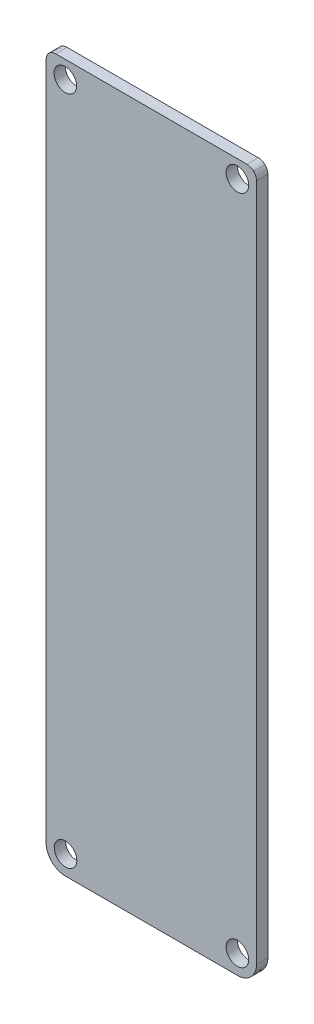
from build123d import *

# Parameters (mm, degrees)
BOSS_EXTRU_1_DEPTH      = 1.5
ESQUISSE2_R             = 1.304771715
ESQUISSE2_R_2           = 1.27
ENL_V_MAT_EXTRU_1_DEPTH = 10
ESQUISSE3_R             = 1.3
ENL_V_MAT_EXTRU_2_DEPTH = 10
ESQUISSE4_R             = 1.3
ENL_V_MAT_EXTRU_3_DEPTH = 10
ESQUISSE6_R             = 1.5
ENL_V_MAT_EXTRU_4_DEPTH = 10


with BuildPart() as part:
    # Model → Boss.-Extru.1 (new body)
    with BuildSketch(Plane.XY):
        with BuildLine():
            Line((110.49, -33.623931), (110.49, -38.623931))
            Line((110.49, -38.623931), (110.49, -39.893931))
            Line((110.49, -39.893931), (110.49, -123.713931))
            add(Edge.make_bspline(
                [(109.746051, -125.509982), (110.222394, -125.03364), (110.49, -124.387581), (110.49, -123.713931)],
                knots=[0, 0, 0, 0, 1, 1, 1, 1], degree=3))
            add(Edge.make_bspline(
                [(107.95, -126.253931), (108.62365, -126.253931), (109.269709, -125.986325), (109.746051, -125.509982)],
                knots=[0, 0, 0, 0, 1, 1, 1, 1], degree=3))
            Line((107.95, -126.253931), (85.09, -126.253931))
            add(Edge.make_bspline(
                [(83.293949, -125.509982), (83.770291, -125.986325), (84.41635, -126.253931), (85.09, -126.253931)],
                knots=[0, 0, 0, 0, 1, 1, 1, 1], degree=3))
            add(Edge.make_bspline(
                [(82.55, -123.713931), (82.55, -124.387581), (82.817606, -125.03364), (83.293949, -125.509982)],
                knots=[0, 0, 0, 0, 1, 1, 1, 1], degree=3))
            Line((82.55, -123.713931), (82.55, -39.893931))
            Line((82.55, -39.893931), (82.55, -38.623931))
            Line((82.55, -38.623931), (82.55, -33.623931))
            add(Edge.make_bspline(
                [(82.921974, -32.725905), (82.683803, -32.964076), (82.55, -33.287106), (82.55, -33.623931)],
                knots=[0, 0, 0, 0, 1, 1, 1, 1], degree=3))
            add(Edge.make_bspline(
                [(83.82, -32.353931), (83.483175, -32.353931), (83.160146, -32.487734), (82.921974, -32.725905)],
                knots=[0, 0, 0, 0, 1, 1, 1, 1], degree=3))
            Line((83.82, -32.353931), (109.22, -32.353931))
            add(Edge.make_bspline(
                [(110.118026, -32.725905), (109.879854, -32.487734), (109.556825, -32.353931), (109.22, -32.353931)],
                knots=[0, 0, 0, 0, 1, 1, 1, 1], degree=3))
            add(Edge.make_bspline(
                [(110.49, -33.623931), (110.49, -33.287106), (110.356197, -32.964076), (110.118026, -32.725905)],
                knots=[0, 0, 0, 0, 1, 1, 1, 1], degree=3))
        make_face()
    extrude(amount=BOSS_EXTRU_1_DEPTH)

    # Esquisse2 → Enlèv. mat.-Extru.1 (cut)
    with BuildSketch(Plane.XY.offset(1.5)):
        with Locations((85.124771715, -123.713931)):
            Circle(ESQUISSE2_R)
        with Locations((122.913557923, -132.317690326)):
            Circle(ESQUISSE2_R_2)
    extrude(amount=-ENL_V_MAT_EXTRU_1_DEPTH, mode=Mode.SUBTRACT)

    # Esquisse3 → Enlèv. mat.-Extru.2 (cut)
    with BuildSketch(Plane.XY.offset(1.5)):
        with Locations((107.943434753, -123.713931)):
            Circle(ESQUISSE3_R)
    extrude(amount=-ENL_V_MAT_EXTRU_2_DEPTH, mode=Mode.SUBTRACT)

    # Esquisse4 → Enlèv. mat.-Extru.3 (cut)
    with BuildSketch(Plane(origin=(0, 0, 0), x_dir=(-1, 0, 0), z_dir=(0, 0, -1))):
        with Locations((-107.943434753, -34.675709558)):
            Circle(ESQUISSE4_R)
        with Locations((-85.096565247, -34.675709558)):
            Circle(ESQUISSE4_R)
    extrude(amount=-ENL_V_MAT_EXTRU_3_DEPTH, mode=Mode.SUBTRACT)

    # Esquisse6 → Enlèv. mat.-Extru.4 (cut)
    with BuildSketch(Plane(origin=(0, 0, 0), x_dir=(-1, 0, 0), z_dir=(0, 0, -1))):
        with Locations((-107.943434753, -34.675709558)):
            Circle(ESQUISSE6_R)
        with Locations((-85.096565247, -34.675709558)):
            Circle(ESQUISSE6_R)
        with Locations((-85.124771715, -123.713931)):
            Circle(ESQUISSE6_R)
        with Locations((-107.943434753, -123.713931)):
            Circle(ESQUISSE6_R)
    extrude(amount=-ENL_V_MAT_EXTRU_4_DEPTH, mode=Mode.SUBTRACT)


solid = part.part
